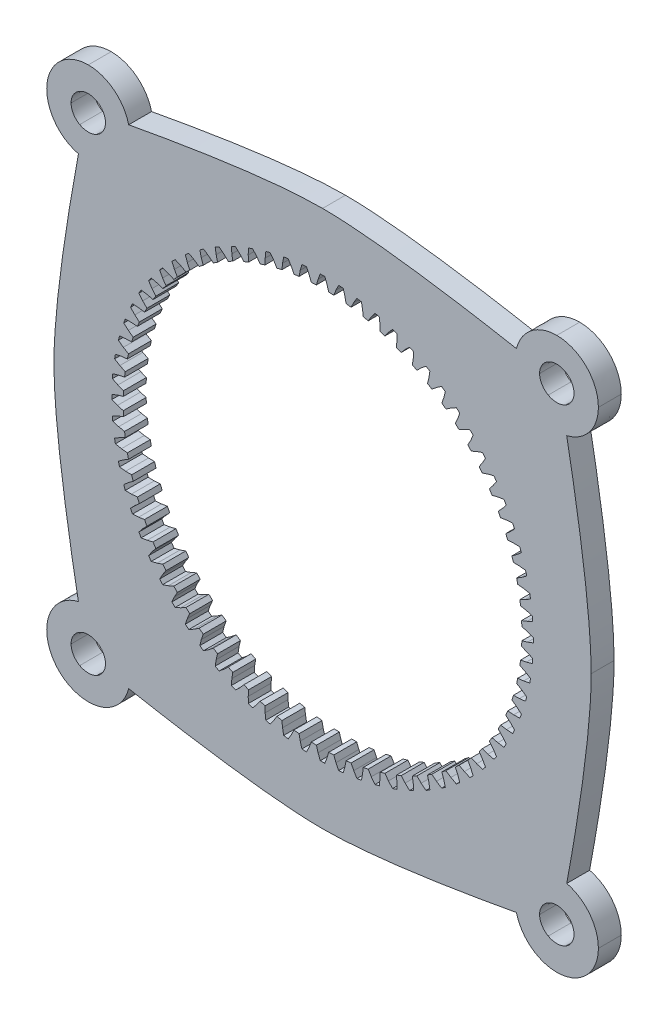
from build123d import *

# Parameters (mm, degrees)
BOSS_EXTRUDE1_DEPTH = 3.175


with BuildPart() as part:
    # ring → Boss-Extrude1 (new body)
    with BuildSketch(Plane(origin=(10.980696762, 0, 0), x_dir=(1, 0, 0), z_dir=(0, 0, 1))):
        with BuildLine():
            add(Edge.make_bspline(
                [(0.90655676, 256.103686298), (-2.27867224, 256.103686298), (-4.86136024, 253.520997298), (-4.86136024, 250.335770298)],
                knots=[0, 0, 0, 0, 1, 1, 1, 1], degree=3))
            add(Edge.make_bspline(
                [(-4.86136024, 250.335770298), (-4.86136024, 247.620419298), (-2.98740724, 245.348149298), (-0.46045724, 244.735422298)],
                knots=[0, 0, 0, 0, 1, 1, 1, 1], degree=3))
            add(Edge.make_bspline(
                [(-0.46045724, 244.735422298), (-1.80349724, 237.525497298), (-3.86476324, 225.289078298), (-3.86476324, 217.827297298)],
                knots=[0, 0, 0, 0, 1, 1, 1, 1], degree=3))
            add(Edge.make_bspline(
                [(-3.86476324, 217.827297298), (-3.86476324, 210.369101298), (-1.81149624, 198.131265298), (-0.46927724, 190.919172298)],
                knots=[0, 0, 0, 0, 1, 1, 1, 1], degree=3))
            add(Edge.make_bspline(
                [(-0.46927724, 190.919172298), (-2.99232824, 190.303682298), (-4.86136024, 188.031410298), (-4.86136024, 185.318825298)],
                knots=[0, 0, 0, 0, 1, 1, 1, 1], degree=3))
            add(Edge.make_bspline(
                [(-4.86136024, 185.318825298), (-4.86136024, 182.133597298), (-2.27867224, 179.550908298), (0.90655676, 179.550908298)],
                knots=[0, 0, 0, 0, 1, 1, 1, 1], degree=3))
            add(Edge.make_bspline(
                [(0.90655676, 179.550908298), (3.61914076, 179.550908298), (5.89141476, 181.419939298), (6.50690376, 183.942992298)],
                knots=[0, 0, 0, 0, 1, 1, 1, 1], degree=3))
            add(Edge.make_bspline(
                [(6.50690376, 183.942992298), (13.71899576, 182.600771298), (25.95683376, 180.547506298), (33.41502876, 180.547506298)],
                knots=[0, 0, 0, 0, 1, 1, 1, 1], degree=3))
            add(Edge.make_bspline(
                [(33.41502876, 180.547506298), (40.87322476, 180.547506298), (53.11106076, 182.600771298), (60.32315376, 183.942992298)],
                knots=[0, 0, 0, 0, 1, 1, 1, 1], degree=3))
            add(Edge.make_bspline(
                [(60.32315376, 183.942992298), (60.93880476, 181.420168298), (63.21107976, 179.550908298), (65.92350076, 179.550908298)],
                knots=[0, 0, 0, 0, 1, 1, 1, 1], degree=3))
            add(Edge.make_bspline(
                [(65.92350076, 179.550908298), (69.10872876, 179.550908298), (71.69141776, 182.133597298), (71.69141776, 185.318825298)],
                knots=[0, 0, 0, 0, 1, 1, 1, 1], degree=3))
            add(Edge.make_bspline(
                [(71.69141776, 185.318825298), (71.69141776, 188.029126298), (69.81916976, 190.301413298), (67.29933476, 190.919172298)],
                knots=[0, 0, 0, 0, 1, 1, 1, 1], degree=3))
            add(Edge.make_bspline(
                [(67.29933476, 190.919172298), (68.64155476, 198.131265298), (70.69482076, 210.369101298), (70.69482076, 217.827297298)],
                knots=[0, 0, 0, 0, 1, 1, 1, 1], degree=3))
            add(Edge.make_bspline(
                [(70.69482076, 217.827297298), (70.69482076, 225.285494298), (68.64155476, 237.523329298), (67.29933476, 244.735422298)],
                knots=[0, 0, 0, 0, 1, 1, 1, 1], degree=3))
            add(Edge.make_bspline(
                [(67.29933476, 244.735422298), (69.81897476, 245.353320298), (71.69141776, 247.625606298), (71.69141776, 250.335770298)],
                knots=[0, 0, 0, 0, 1, 1, 1, 1], degree=3))
            add(Edge.make_bspline(
                [(71.69141776, 250.335770298), (71.69141776, 253.520997298), (69.10872876, 256.103686298), (65.92350076, 256.103686298)],
                knots=[0, 0, 0, 0, 1, 1, 1, 1], degree=3))
            add(Edge.make_bspline(
                [(65.92350076, 256.103686298), (63.21333776, 256.103686298), (60.94105076, 254.231243298), (60.32315376, 251.711603298)],
                knots=[0, 0, 0, 0, 1, 1, 1, 1], degree=3))
            add(Edge.make_bspline(
                [(60.32315376, 251.711603298), (53.11106076, 253.053824298), (40.87322476, 255.107089298), (33.41502876, 255.107089298)],
                knots=[0, 0, 0, 0, 1, 1, 1, 1], degree=3))
            add(Edge.make_bspline(
                [(33.41502876, 255.107089298), (25.95534276, 255.107089298), (13.71770176, 253.045859298), (6.50690376, 251.702783298)],
                knots=[0, 0, 0, 0, 1, 1, 1, 1], degree=3))
            add(Edge.make_bspline(
                [(6.50690376, 251.702783298), (5.89218576, 254.226925298), (3.61991476, 256.103686298), (0.90655676, 256.103686298)],
                knots=[0, 0, 0, 0, 1, 1, 1, 1], degree=3))
        make_face()
        Polygon((61.06956976, 218.676198298), (61.86656476, 218.446751298), (62.66214976, 218.139976298), (62.66214976, 217.511749298), (61.86656476, 217.204973298), (61.06956976, 216.975527298), (61.03852476, 216.262633298), (61.81237876, 215.964607298), (62.57804676, 215.589533298), (62.52329576, 214.963847298), (61.70400476, 214.727627298), (60.89035876, 214.568171298), (60.79722476, 213.860922298), (61.54200976, 213.496573298), (62.27211876, 213.056307298), (62.16318076, 212.437676298), (61.32639176, 212.273705298), (60.50173876, 212.185933298), (60.34736276, 211.489409298), (61.05771576, 211.061560298), (61.74662076, 210.559205298), (61.58406076, 209.952427298), (60.73626476, 209.862116298), (59.90709576, 209.846593298), (59.69260676, 209.166156298), (60.36288476, 208.677911298), (61.00550476, 208.117418298), (60.79073376, 207.527291298), (59.93814076, 207.511205298), (59.11094676, 207.567931298), (58.83775576, 206.908660298), (59.46316076, 206.363971298), (60.05441576, 205.749573298), (59.78912676, 205.180331298), (58.93822676, 205.238469298), (58.11893576, 205.367162298), (57.78958276, 204.734420298), (58.36503376, 204.137238298), (58.90069176, 203.473733298), (58.58657876, 202.929891298), (57.74414476, 203.061971298), (56.93924676, 203.261502298), (56.55598976, 202.659805298), (57.07697176, 202.014645298), (57.55279876, 201.306831298), (57.19240076, 200.792622298), (56.36464276, 200.997516298), (55.58034676, 201.266473298), (55.14600676, 200.700618298), (55.60885176, 200.012560298), (56.02117876, 199.266082298), (55.61731876, 198.784893298), (54.81072676, 199.061189298), (54.05267876, 199.397598298), (53.57064276, 198.871536298), (53.97196276, 198.145660298), (54.31740276, 197.366162298), (53.87346676, 196.922227298), (53.09396976, 197.267667298), (52.36809376, 197.668987298), (51.84203176, 197.186951298), (52.17844076, 196.428902298), (52.45473576, 195.622311298), (51.97354676, 195.218451298), (51.22706976, 195.630778298), (50.53901176, 196.093622298), (49.97315576, 195.659282298), (50.24211376, 194.874987298), (50.44700676, 194.047229298), (49.93279876, 193.686831298), (49.22498476, 194.162658298), (48.57982476, 194.683640298), (47.97812676, 194.300382298), (48.17765876, 193.495485298), (48.30973876, 192.653051298), (47.76589576, 192.338938298), (47.10239176, 192.874596298), (46.50520976, 193.450047298), (45.87246676, 193.120693298), (46.00116076, 192.301402298), (46.05929876, 191.450502298), (45.49005576, 191.185213298), (44.87565876, 191.776469298), (44.33096976, 192.401873298), (43.67169876, 192.128682298), (43.72842476, 191.301489298), (43.71233876, 190.448896298), (43.12221176, 190.234125298), (42.56171876, 190.876745298), (42.07347376, 191.547022298), (41.39303576, 191.332533298), (41.37751376, 190.503365298), (41.28720276, 189.655569298), (40.68042476, 189.493009298), (40.17806976, 190.181913298), (39.75022076, 190.892267298), (39.05369576, 190.737891298), (38.96592476, 189.913238298), (38.80195376, 189.076449298), (38.18332276, 188.967511298), (37.74305576, 189.697620298), (37.37870676, 190.442405298), (36.67145876, 190.349271298), (36.51200276, 189.535625298), (36.27578276, 188.716333298), (35.65009576, 188.661582298), (35.27502276, 189.427251298), (34.97699576, 190.201105298), (34.26410276, 190.170060298), (34.03465576, 189.373065298), (33.72788076, 188.577480298), (33.09965376, 188.577480298), (32.79287876, 189.373065298), (32.56343176, 190.170060298), (31.85053876, 190.201105298), (31.55251176, 189.427251298), (31.17743876, 188.661582298), (30.55175176, 188.716333298), (30.31553176, 189.535625298), (30.15607576, 190.349271298), (29.44882676, 190.442405298), (29.08447876, 189.697620298), (28.64421176, 188.967511298), (28.02558076, 189.076449298), (27.86160976, 189.913238298), (27.77383876, 190.737891298), (27.07731376, 190.892267298), (26.64946476, 190.181913298), (26.14710976, 189.493009298), (25.54033176, 189.655569298), (25.45002076, 190.503365298), (25.43449876, 191.332533298), (24.75406076, 191.547022298), (24.26581576, 190.876745298), (23.70532276, 190.234125298), (23.11519576, 190.448896298), (23.09910976, 191.301489298), (23.15583576, 192.128682298), (22.49656476, 192.401873298), (21.95187576, 191.776469298), (21.33747876, 191.185213298), (20.76823576, 191.450502298), (20.82637376, 192.301402298), (20.95506676, 193.120693298), (20.32232476, 193.450047298), (19.72514276, 192.874596298), (19.06163876, 192.338938298), (18.51779576, 192.653051298), (18.64987576, 193.495485298), (18.84940676, 194.300382298), (18.24770976, 194.683640298), (17.60254976, 194.162658298), (16.89473576, 193.686831298), (16.38052676, 194.047229298), (16.58542076, 194.874987298), (16.85437876, 195.659282298), (16.28852276, 196.093622298), (15.60046476, 195.630778298), (14.85398676, 195.218451298), (14.37279876, 195.622311298), (14.64909376, 196.428902298), (14.98550276, 197.186951298), (14.45944076, 197.668987298), (13.73356476, 197.267667298), (12.95406676, 196.922227298), (12.51013176, 197.366162298), (12.85557176, 198.145660298), (13.25689176, 198.871536298), (12.77485576, 199.397598298), (12.01680676, 199.061189298), (11.21021576, 198.784893298), (10.80635576, 199.266082298), (11.21868276, 200.012560298), (11.68152676, 200.700618298), (11.24718676, 201.266473298), (10.46289176, 200.997516298), (9.63513376, 200.792622298), (9.27473576, 201.306831298), (9.75056276, 202.014645298), (10.27154476, 202.659805298), (9.88828676, 203.261502298), (9.08338976, 203.061971298), (8.24095576, 202.929891298), (7.92684276, 203.473733298), (8.46250076, 204.137238298), (9.03795176, 204.734420298), (8.70859876, 205.367162298), (7.88930676, 205.238469298), (7.03840676, 205.180331298), (6.77311876, 205.749573298), (7.36437376, 206.363971298), (7.98977876, 206.908660298), (7.71658676, 207.567931298), (6.88939376, 207.511205298), (6.03680076, 207.527291298), (5.82202976, 208.117418298), (6.46464976, 208.677911298), (7.13492676, 209.166156298), (6.92043876, 209.846593298), (6.09126976, 209.862116298), (5.24347376, 209.952427298), (5.08091376, 210.559205298), (5.76981876, 211.061560298), (6.48017176, 211.489409298), (6.32579576, 212.185933298), (5.50114276, 212.273705298), (4.66435376, 212.437676298), (4.55541576, 213.056307298), (5.28552476, 213.496573298), (6.03030976, 213.860922298), (5.93717576, 214.568171298), (5.12352976, 214.727627298), (4.30423876, 214.963847298), (4.24948676, 215.589533298), (5.01515576, 215.964607298), (5.78900976, 216.262633298), (5.75796476, 216.975527298), (4.96096976, 217.204973298), (4.16538476, 217.511749298), (4.16538476, 218.139976298), (4.96096976, 218.446751298), (5.75796476, 218.676198298), (5.78900976, 219.389091298), (5.01515576, 219.687118298), (4.24948676, 220.062191298), (4.30423876, 220.687878298), (5.12352976, 220.924098298), (5.93717576, 221.083553298), (6.03030976, 221.790802298), (5.28552476, 222.155151298), (4.55541576, 222.595418298), (4.66435376, 223.214049298), (5.50114276, 223.378020298), (6.32579576, 223.465791298), (6.48017176, 224.162316298), (5.76981876, 224.590165298), (5.08091376, 225.092520298), (5.24347376, 225.699298298), (6.09126976, 225.789609298), (6.92043876, 225.805131298), (7.13492676, 226.485569298), (6.46464976, 226.973813298), (5.82202976, 227.534307298), (6.03680076, 228.124433298), (6.88939376, 228.140520298), (7.71658676, 228.083793298), (7.98977876, 228.743065298), (7.36437376, 229.287753298), (6.77311876, 229.902151298), (7.03840676, 230.471393298), (7.88930676, 230.413256298), (8.70859876, 230.284562298), (9.03795176, 230.917305298), (8.46250076, 231.514487298), (7.92684276, 232.177991298), (8.24095576, 232.721833298), (9.08338976, 232.589753298), (9.88828676, 232.390222298), (10.27154476, 232.991920298), (9.75056276, 233.637080298), (9.27473576, 234.344893298), (9.63513376, 234.859102298), (10.46289176, 234.654209298), (11.24718676, 234.385251298), (11.68152676, 234.951107298), (11.21868276, 235.639165298), (10.80635576, 236.385642298), (11.21021576, 236.866831298), (12.01680676, 236.590536298), (12.77485576, 236.254127298), (13.25689176, 236.780189298), (12.85557176, 237.506065298), (12.51013176, 238.285562298), (12.95406676, 238.729498298), (13.73356476, 238.384058298), (14.45944076, 237.982738298), (14.98550276, 238.464773298), (14.64909376, 239.222822298), (14.37279876, 240.029413298), (14.85398676, 240.433273298), (15.60046476, 240.020947298), (16.28852276, 239.558102298), (16.85437876, 239.992442298), (16.58542076, 240.776738298), (16.38052676, 241.604496298), (16.89473576, 241.964893298), (17.60254976, 241.489067298), (18.24770976, 240.968085298), (18.84940676, 241.351342298), (18.64987576, 242.156240298), (18.51779576, 242.998673298), (19.06163876, 243.312787298), (19.72514276, 242.777129298), (20.32232476, 242.201678298), (20.95506676, 242.531031298), (20.82637376, 243.350322298), (20.76823576, 244.201222298), (21.33747876, 244.466511298), (21.95187576, 243.875256298), (22.49656476, 243.249851298), (23.15583576, 243.523042298), (23.09910976, 244.350236298), (23.11519576, 245.202829298), (23.70532276, 245.417600298), (24.26581576, 244.774980298), (24.75406076, 244.104702298), (25.43449876, 244.319191298), (25.45002076, 245.148360298), (25.54033176, 245.996156298), (26.14710976, 246.158716298), (26.64946476, 245.469811298), (27.07731376, 244.759458298), (27.77383876, 244.913833298), (27.86160976, 245.738487298), (28.02558076, 246.575276298), (28.64421176, 246.684213298), (29.08447876, 245.954105298), (29.44882676, 245.209320298), (30.15607576, 245.302453298), (30.31553176, 246.116100298), (30.55175176, 246.935391298), (31.17743876, 246.990142298), (31.55251176, 246.224473298), (31.85053876, 245.450620298), (32.56343176, 245.481665298), (32.79287876, 246.278660298), (33.09965376, 247.074245298), (33.72788076, 247.074245298), (34.03465576, 246.278660298), (34.26410276, 245.481665298), (34.97699576, 245.450620298), (35.27502276, 246.224473298), (35.65009576, 246.990142298), (36.27578276, 246.935391298), (36.51200276, 246.116100298), (36.67145876, 245.302453298), (37.37870676, 245.209320298), (37.74305576, 245.954105298), (38.18332276, 246.684213298), (38.80195376, 246.575276298), (38.96592476, 245.738487298), (39.05369576, 244.913833298), (39.75022076, 244.759458298), (40.17806976, 245.469811298), (40.68042476, 246.158716298), (41.28720276, 245.996156298), (41.37751376, 245.148360298), (41.39303576, 244.319191298), (42.07347376, 244.104702298), (42.56171876, 244.774980298), (43.12221176, 245.417600298), (43.71233876, 245.202829298), (43.72842476, 244.350236298), (43.67169876, 243.523042298), (44.33096976, 243.249851298), (44.87565876, 243.875256298), (45.49005576, 244.466511298), (46.05929876, 244.201222298), (46.00116076, 243.350322298), (45.87246676, 242.531031298), (46.50520976, 242.201678298), (47.10239176, 242.777129298), (47.76589576, 243.312787298), (48.30973876, 242.998673298), (48.17765876, 242.156240298), (47.97812676, 241.351342298), (48.57982476, 240.968085298), (49.22498476, 241.489067298), (49.93279876, 241.964893298), (50.44700676, 241.604496298), (50.24211376, 240.776738298), (49.97315576, 239.992442298), (50.53901176, 239.558102298), (51.22706976, 240.020947298), (51.97354676, 240.433273298), (52.45473576, 240.029413298), (52.17844076, 239.222822298), (51.84203176, 238.464773298), (52.36809376, 237.982738298), (53.09396976, 238.384058298), (53.87346676, 238.729498298), (54.31740276, 238.285562298), (53.97196276, 237.506065298), (53.57064276, 236.780189298), (54.05267876, 236.254127298), (54.81072676, 236.590536298), (55.61731876, 236.866831298), (56.02117876, 236.385642298), (55.60885176, 235.639165298), (55.14600676, 234.951107298), (55.58034676, 234.385251298), (56.36464276, 234.654209298), (57.19240076, 234.859102298), (57.55279876, 234.344893298), (57.07697176, 233.637080298), (56.55598976, 232.991920298), (56.93924676, 232.390222298), (57.74414476, 232.589753298), (58.58657876, 232.721833298), (58.90069176, 232.177991298), (58.36503376, 231.514487298), (57.78958276, 230.917305298), (58.11893576, 230.284562298), (58.93822676, 230.413256298), (59.78912676, 230.471393298), (60.05441576, 229.902151298), (59.46316076, 229.287753298), (58.83775576, 228.743065298), (59.11094676, 228.083793298), (59.93814076, 228.140520298), (60.79073376, 228.124433298), (61.00550476, 227.534307298), (60.36288476, 226.973813298), (59.69260676, 226.485569298), (59.90709576, 225.805131298), (60.73626476, 225.789609298), (61.58406076, 225.699298298), (61.74662076, 225.092520298), (61.05771576, 224.590165298), (60.34736276, 224.162316298), (60.50173876, 223.465791298), (61.32639176, 223.378020298), (62.16318076, 223.214049298), (62.27211876, 222.595418298), (61.54200976, 222.155151298), (60.79722476, 221.790802298), (60.89035876, 221.083553298), (61.70400476, 220.924098298), (62.52329576, 220.687878298), (62.57804676, 220.062191298), (61.81237876, 219.687118298), (61.03852476, 219.389091298), align=None, mode=Mode.SUBTRACT)
        with BuildLine():
            add(Edge.make_bspline(
                [(3.29029976, 250.335122298), (3.29029976, 249.510287298), (2.83557076, 248.748108298), (2.09740476, 248.335690298)],
                knots=[0, 0, 0, 0, 1, 1, 1, 1], degree=3))
            add(Edge.make_bspline(
                [(2.09740476, 248.335690298), (1.35923776, 247.923273298), (0.44977976, 247.923273298), (-0.28838624, 248.335690298)],
                knots=[0, 0, 0, 0, 1, 1, 1, 1], degree=3))
            add(Edge.make_bspline(
                [(-0.28838624, 248.335690298), (-1.02655324, 248.748108298), (-1.48128224, 249.510287298), (-1.48128224, 250.335122298)],
                knots=[0, 0, 0, 0, 1, 1, 1, 1], degree=3))
            add(Edge.make_bspline(
                [(-1.48128224, 250.335122298), (-1.48128224, 251.159956298), (-1.02655324, 251.922135298), (-0.28838624, 252.334553298)],
                knots=[0, 0, 0, 0, 1, 1, 1, 1], degree=3))
            add(Edge.make_bspline(
                [(-0.28838624, 252.334553298), (0.44977976, 252.746970298), (1.35923776, 252.746970298), (2.09740476, 252.334553298)],
                knots=[0, 0, 0, 0, 1, 1, 1, 1], degree=3))
            add(Edge.make_bspline(
                [(2.09740476, 252.334553298), (2.83557076, 251.922135298), (3.29029976, 251.159956298), (3.29029976, 250.335122298)],
                knots=[0, 0, 0, 0, 1, 1, 1, 1], degree=3))
        make_face(mode=Mode.SUBTRACT)
        with BuildLine():
            add(Edge.make_bspline(
                [(68.30881676, 185.316604298), (68.30881676, 184.491769298), (67.85408676, 183.729591298), (67.11592076, 183.317173298)],
                knots=[0, 0, 0, 0, 1, 1, 1, 1], degree=3))
            add(Edge.make_bspline(
                [(67.11592076, 183.317173298), (66.37775476, 182.904756298), (65.46829676, 182.904756298), (64.73012976, 183.317173298)],
                knots=[0, 0, 0, 0, 1, 1, 1, 1], degree=3))
            add(Edge.make_bspline(
                [(64.73012976, 183.317173298), (63.99196376, 183.729591298), (63.53723476, 184.491769298), (63.53723476, 185.316604298)],
                knots=[0, 0, 0, 0, 1, 1, 1, 1], degree=3))
            add(Edge.make_bspline(
                [(63.53723476, 185.316604298), (63.53723476, 186.141439298), (63.99196376, 186.903618298), (64.73012976, 187.316035298)],
                knots=[0, 0, 0, 0, 1, 1, 1, 1], degree=3))
            add(Edge.make_bspline(
                [(64.73012976, 187.316035298), (65.46829676, 187.728453298), (66.37775476, 187.728453298), (67.11592076, 187.316035298)],
                knots=[0, 0, 0, 0, 1, 1, 1, 1], degree=3))
            add(Edge.make_bspline(
                [(67.11592076, 187.316035298), (67.85408676, 186.903618298), (68.30881676, 186.141439298), (68.30881676, 185.316604298)],
                knots=[0, 0, 0, 0, 1, 1, 1, 1], degree=3))
        make_face(mode=Mode.SUBTRACT)
        with BuildLine():
            add(Edge.make_bspline(
                [(3.29029976, 185.316604298), (3.29029976, 184.491769298), (2.83557076, 183.729591298), (2.09740476, 183.317173298)],
                knots=[0, 0, 0, 0, 1, 1, 1, 1], degree=3))
            add(Edge.make_bspline(
                [(2.09740476, 183.317173298), (1.35923876, 182.904756298), (0.44977976, 182.904756298), (-0.28838624, 183.317173298)],
                knots=[0, 0, 0, 0, 1, 1, 1, 1], degree=3))
            add(Edge.make_bspline(
                [(-0.28838624, 183.317173298), (-1.02655224, 183.729591298), (-1.48128224, 184.491769298), (-1.48128224, 185.316604298)],
                knots=[0, 0, 0, 0, 1, 1, 1, 1], degree=3))
            add(Edge.make_bspline(
                [(-1.48128224, 185.316604298), (-1.48128224, 186.141439298), (-1.02655224, 186.903618298), (-0.28838624, 187.316035298)],
                knots=[0, 0, 0, 0, 1, 1, 1, 1], degree=3))
            add(Edge.make_bspline(
                [(-0.28838624, 187.316035298), (0.44977976, 187.728453298), (1.35923876, 187.728453298), (2.09740476, 187.316035298)],
                knots=[0, 0, 0, 0, 1, 1, 1, 1], degree=3))
            add(Edge.make_bspline(
                [(2.09740476, 187.316035298), (2.83557076, 186.903618298), (3.29029976, 186.141439298), (3.29029976, 185.316604298)],
                knots=[0, 0, 0, 0, 1, 1, 1, 1], degree=3))
        make_face(mode=Mode.SUBTRACT)
        with BuildLine():
            add(Edge.make_bspline(
                [(68.30881676, 250.335120298), (68.30881676, 249.510285298), (67.85408676, 248.748106298), (67.11592076, 248.335689298)],
                knots=[0, 0, 0, 0, 1, 1, 1, 1], degree=3))
            add(Edge.make_bspline(
                [(67.11592076, 248.335689298), (66.37775476, 247.923272298), (65.46829676, 247.923272298), (64.73012976, 248.335689298)],
                knots=[0, 0, 0, 0, 1, 1, 1, 1], degree=3))
            add(Edge.make_bspline(
                [(64.73012976, 248.335689298), (63.99196376, 248.748106298), (63.53723476, 249.510285298), (63.53723476, 250.335120298)],
                knots=[0, 0, 0, 0, 1, 1, 1, 1], degree=3))
            add(Edge.make_bspline(
                [(63.53723476, 250.335120298), (63.53723476, 251.159955298), (63.99196376, 251.922134298), (64.73012976, 252.334551298)],
                knots=[0, 0, 0, 0, 1, 1, 1, 1], degree=3))
            add(Edge.make_bspline(
                [(64.73012976, 252.334551298), (65.46829676, 252.746969298), (66.37775476, 252.746969298), (67.11592076, 252.334551298)],
                knots=[0, 0, 0, 0, 1, 1, 1, 1], degree=3))
            add(Edge.make_bspline(
                [(67.11592076, 252.334551298), (67.85408676, 251.922134298), (68.30881676, 251.159955298), (68.30881676, 250.335120298)],
                knots=[0, 0, 0, 0, 1, 1, 1, 1], degree=3))
        make_face(mode=Mode.SUBTRACT)
    extrude(amount=BOSS_EXTRUDE1_DEPTH)


solid = part.part
